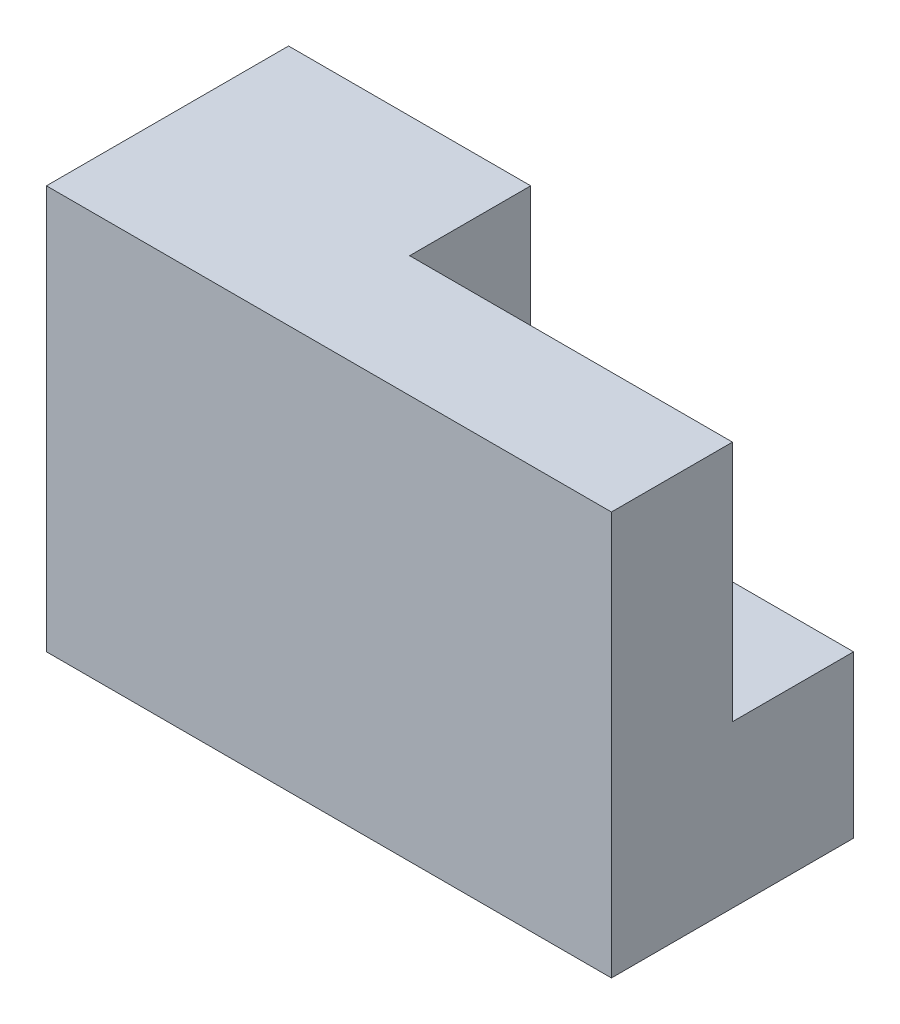
from build123d import *

# Parameters (mm, degrees)
BOSS_EXTRUDE3_DEPTH      = 30
BOSS_EXTRUDE3_DEPTH_BACK = 0.0001
SKETCH4_W                = 70
SKETCH4_H                = 20
SKETCH6_W                = 30
SKETCH6_H                = 30.0001
BOSS_EXTRUDE4_DEPTH      = 30
SKETCH7_W                = 40
SKETCH7_H                = 15.00005
BOSS_EXTRUDE5_DEPTH      = 30


with BuildPart() as part:
    # Sketch4 → Boss-Extrude3 (new, two sides: drawn at the far end of the back side and taken through both)
    with BuildSketch(Plane.XY.offset(-BOSS_EXTRUDE3_DEPTH_BACK)):
        with Locations((35, 10)):
            Rectangle(SKETCH4_W, SKETCH4_H)
    extrude(amount=BOSS_EXTRUDE3_DEPTH + BOSS_EXTRUDE3_DEPTH_BACK)

    # Sketch6 → Boss-Extrude4 (add)
    with BuildSketch(Plane(origin=(0, 20, 0), x_dir=(1, 0, 0), z_dir=(0, 1, 0))):
        with Locations((15, -14.99995)):
            Rectangle(SKETCH6_W, SKETCH6_H)
    extrude(amount=BOSS_EXTRUDE4_DEPTH)

    # Sketch7 → Boss-Extrude5 (add)
    with BuildSketch(Plane(origin=(0, 20, 0), x_dir=(1, 0, 0), z_dir=(0, 1, 0))):
        with Locations((50, -22.499975)):
            Rectangle(SKETCH7_W, SKETCH7_H)
    extrude(amount=BOSS_EXTRUDE5_DEPTH)


solid = part.part
